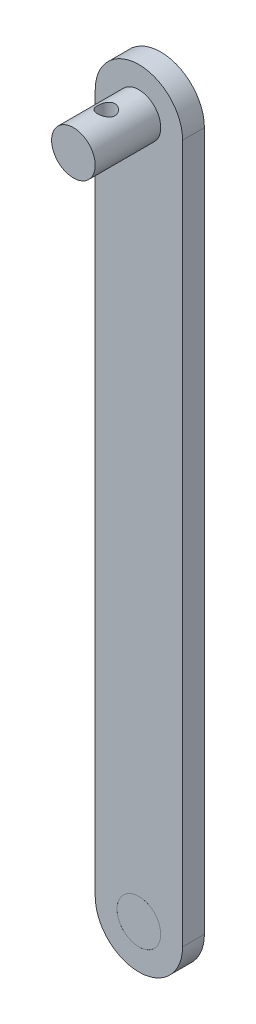
from build123d import *

# Parameters (mm, degrees)
SKETCH1_R           = 6.35
BOSS_EXTRUDE1_DEPTH = 6.35
SKETCH2_R           = 6.35
BOSS_EXTRUDE3_DEPTH = 25.4
SKETCH4_R           = 6.35
BOSS_EXTRUDE4_DEPTH = 6.35
SKETCH5_R           = 2.54
CUT_EXTRUDE2_DEPTH  = 118.774954893


with BuildPart() as part:
    # Sketch1 → Boss-Extrude1 (new body)
    with BuildSketch(Plane.XY):
        with BuildLine():
            Line((-12.7, -101.6), (-12.7, 101.6))
            ThreePointArc((-12.7, 101.6), (0, 114.3), (12.7, 101.6))
            Line((12.7, 101.6), (12.7, -101.6))
            ThreePointArc((12.7, -101.6), (0, -114.3), (-12.7, -101.6))
        make_face()
        with Locations((0, 101.6)):
            Circle(SKETCH1_R, mode=Mode.SUBTRACT)
        with Locations(Location((0, -101.6, 0), (0, 0, 180))):
            Circle(SKETCH1_R, mode=Mode.SUBTRACT)
    extrude(amount=BOSS_EXTRUDE1_DEPTH)

    # Sketch2 → Boss-Extrude3 (add)
    with BuildSketch(Plane.XY):
        with Locations((0, 101.6)):
            Circle(SKETCH2_R)
    extrude(amount=BOSS_EXTRUDE3_DEPTH)

    # Sketch5 → Cut-Extrude2 (cut, through all)
    with BuildSketch(Plane(origin=(0, 0, 0), x_dir=(1, 0, 0), z_dir=(0, 1, 0))):
        with Locations(Location((0, -15.875, 0), (0, 0, 90))):
            Circle(SKETCH5_R)
    extrude(amount=CUT_EXTRUDE2_DEPTH, mode=Mode.SUBTRACT)


with BuildPart() as body_2:
    # Sketch4 → Boss-Extrude4 (new, symmetric)
    with BuildSketch(Plane.XY):
        with Locations((0, -101.6)):
            Circle(SKETCH4_R)
    extrude(amount=BOSS_EXTRUDE4_DEPTH, both=True)


solid = Compound([part.part, body_2.part])
